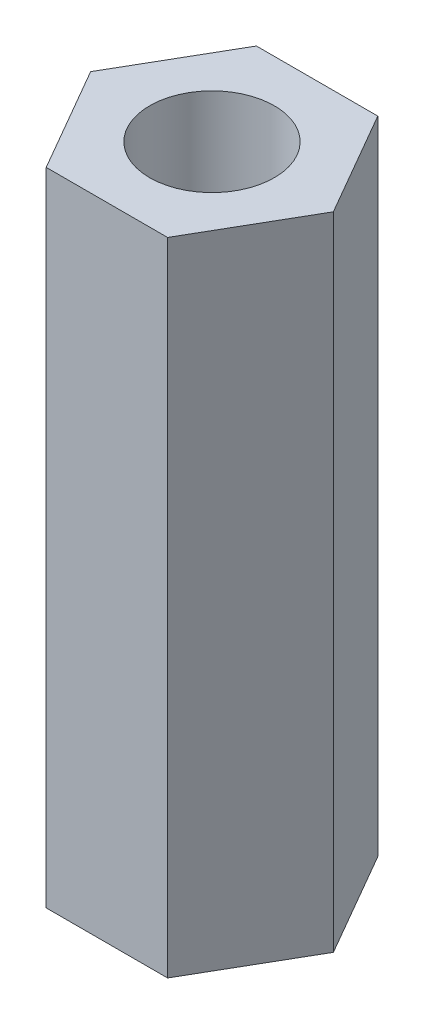
from build123d import *

# Parameters (mm, degrees)
SKETCH1_R           = 1.75
BOSS_EXTRUDE1_DEPTH = 9


with BuildPart() as part:
    # Sketch1 → Boss-Extrude1 (new, symmetric)
    with BuildSketch(Plane(origin=(0, 0, 0), x_dir=(1, 0, 0), z_dir=(0, 1, 0))):
        Polygon((3.406366588, 0), (1.703183294, 2.95), (-1.703183294, 2.95), (-3.406366588, 0), (-1.703183294, -2.95), (1.703183294, -2.95), align=None)
        with Locations(Location((0, 0, 0), (0, 0, 270))):
            Circle(SKETCH1_R, mode=Mode.SUBTRACT)
    extrude(amount=BOSS_EXTRUDE1_DEPTH, both=True)


solid = part.part
